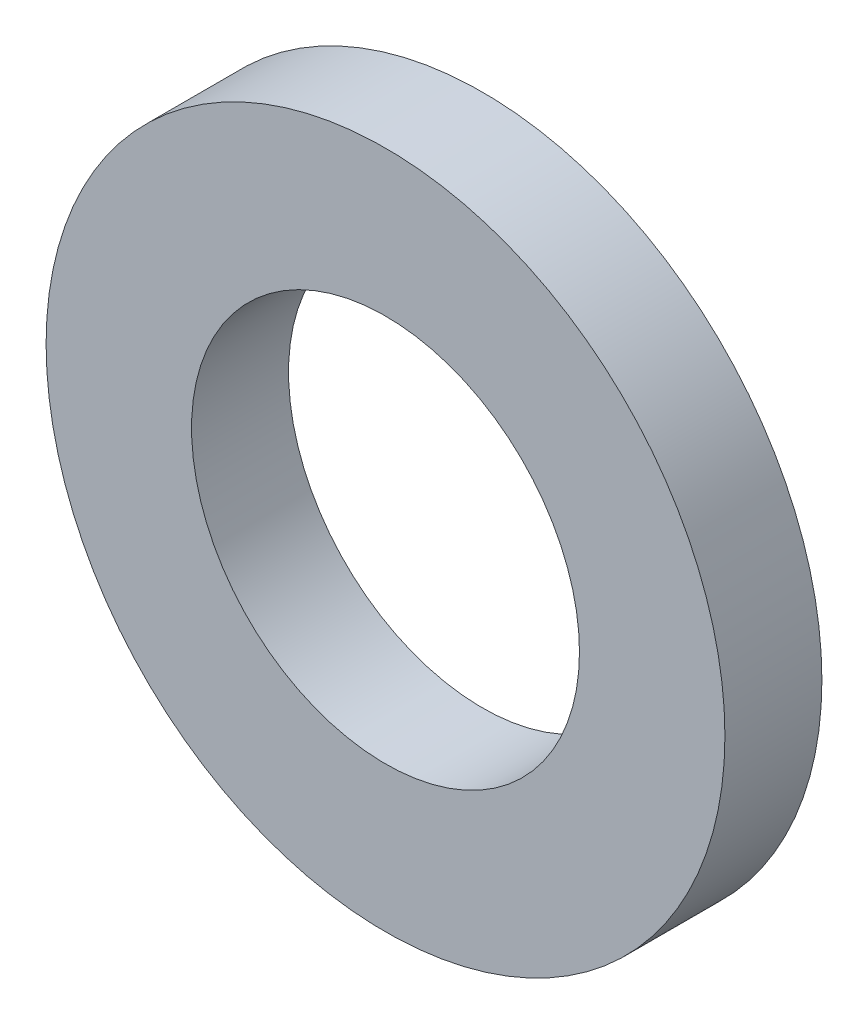
from build123d import *

# Parameters (mm, degrees)
SKETCH_1_R      = 3.5
SKETCH_1_R_2    = 2
EXTRUDE_1_DEPTH = 1


with BuildPart() as part:
    # 草图1 → 凸台-拉伸1 (new body)
    with BuildSketch(Plane.XY):
        Circle(SKETCH_1_R)
        Circle(SKETCH_1_R_2, mode=Mode.SUBTRACT)
    extrude(amount=EXTRUDE_1_DEPTH)


solid = part.part
